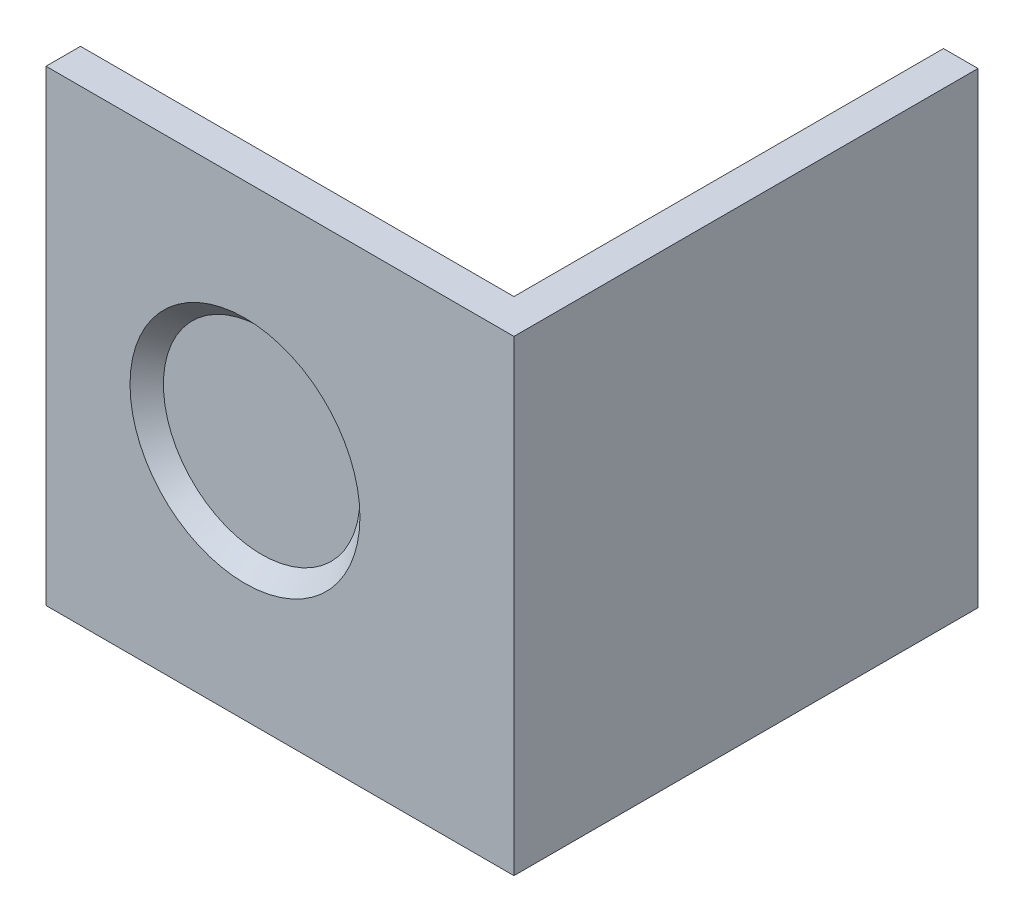
from build123d import *

# Parameters (mm, degrees)
BOSS_EXTRUDE1_DEPTH = 41.97
SKETCH2_R           = 10.33
CUT_EXTRUDE2_DEPTH  = 1.5
CUT_EXTRUDE2_TAPER  = 45


with BuildPart() as part:
    # Sketch1 → Boss-Extrude1 (new body)
    with BuildSketch(Plane(origin=(0, 0, 0), x_dir=(1, 0, 0), z_dir=(0, 1, 0))):
        Polygon((0, 0), (42.05, 0), (42.05, 41.7), (38.95, 41.7), (38.95, 3.1), (0, 3.1), align=None)
    extrude(amount=BOSS_EXTRUDE1_DEPTH)

    # Sketch2 → Cut-Extrude2 (cut)
    with BuildSketch(Plane(origin=(42.05, 0, 0), x_dir=(-1, 0, 0), z_dir=(0, 0, -1))):
        with Locations((24.17, 20.985)):
            Circle(SKETCH2_R)
    extrude(amount=CUT_EXTRUDE2_DEPTH, taper=CUT_EXTRUDE2_TAPER, mode=Mode.SUBTRACT)


solid = part.part
